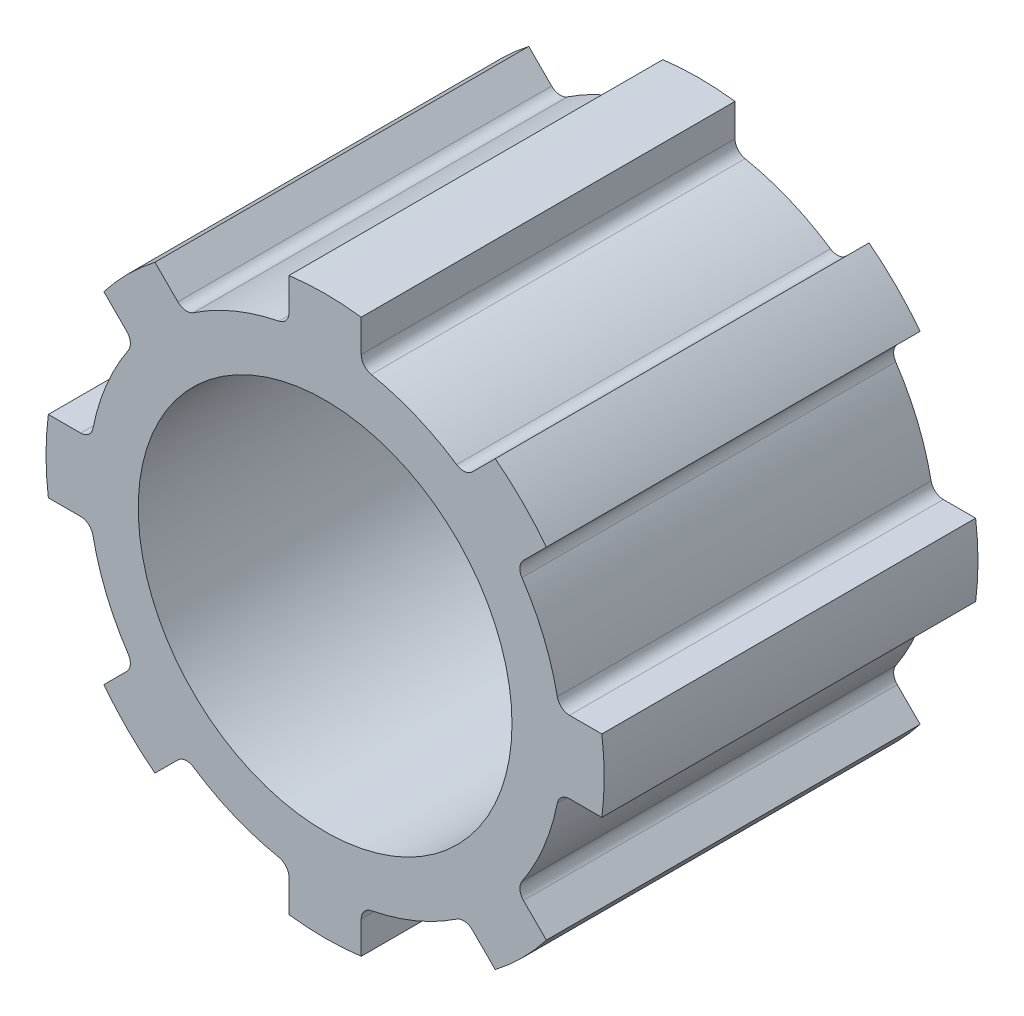
from build123d import *

# Parameters (mm, degrees)
SKETCH_2_W                       = 60
SKETCH_2_H                       = 14.8
CUT_EXTRUDE_1_DEPTH              = 88.258695842
FILLET_2_R                       = 2
PATTERN_CIRCULAR_1_COUNT         = 8
FILLET_2_OF_PATTERN_CIRCULAR_1_R = 2


with BuildPart() as part:
    # Эскиз2 → Повернуть1 (revolve)
    with BuildSketch(Plane(origin=(0, 0, 0), x_dir=(0, 0, -1), z_dir=(1, 0, 0)), mode=Mode.PRIVATE) as revolve_1_sk:
        with Locations((30, 37.4)):
            Rectangle(SKETCH_2_W, SKETCH_2_H)
    revolve(revolve_1_sk.sketch.rotate(Axis((0, 0, 0), (0, 0, -1)), 90), axis=Axis((0, 0, 0), (0, 0, -1)))

    # Эскиз4 → Вырез-Вытянуть1 (cut, through all)
    with BuildSketch(Plane.XY):
        with BuildLine():
            Line((-5.8, 37.554760018), (-5.8, 44.422967033))
            ThreePointArc((-5.8, 44.422967033), (-11.571918734, 43.279679953), (-17.14421777, 41.389803057))
            Line((-17.14421777, 41.389803057), (-14.54197043, 35.107422235))
            ThreePointArc((-14.54197043, 35.107422235), (-10.244330422, 36.5930826), (-5.8, 37.554760018))
        make_face()
        with BuildLine():
            Line((5.8, 37.554760018), (5.8, 44.422967033))
            ThreePointArc((5.8, 44.422967033), (11.571918734, 43.279679953), (17.14421777, 41.389803057))
            Line((17.14421777, 41.389803057), (14.54197043, 35.107422235))
            ThreePointArc((14.54197043, 35.107422235), (10.244330422, 36.5930826), (5.8, 37.554760018))
        make_face()
    cut_extrude_1 = extrude(amount=-CUT_EXTRUDE_1_DEPTH, mode=Mode.SUBTRACT)

    # Скругление2
    fillet_2_edges = [part.edges().sort_by_distance(p)[0] for p in [
        (-5.8, 37.554760018, -30),
        (5.8, 37.554760018, -30),
    ]]
    fillet(fillet_2_edges, radius=FILLET_2_R)

    # Круговой массив1: Вырез-Вытянуть1 ×8 about axis
    pattern_circular_1_axis = Axis((0, 0, 0), (0, 0, 1))
    for i in range(1, PATTERN_CIRCULAR_1_COUNT):
        add(cut_extrude_1.rotate(pattern_circular_1_axis, i * 360 / PATTERN_CIRCULAR_1_COUNT), mode=Mode.SUBTRACT)

    # Скругление2 of Круговой массив1
    fillet_2_of_pattern_circular_1_edges = [part.edges().sort_by_distance(p)[0] for p in [
        (-30.656444805, 22.454006144, -30),
        (-22.454006144, 30.656444805, -30),
        (-37.554760018, -5.8, -30),
        (-37.554760018, 5.8, -30),
        (-22.454006144, -30.656444805, -30),
        (-30.656444805, -22.454006144, -30),
        (5.8, -37.554760018, -30),
        (-5.8, -37.554760018, -30),
        (30.656444805, -22.454006144, -30),
        (22.454006144, -30.656444805, -30),
        (37.554760018, 5.8, -30),
        (37.554760018, -5.8, -30),
        (22.454006144, 30.656444805, -30),
        (30.656444805, 22.454006144, -30),
    ]]
    fillet(fillet_2_of_pattern_circular_1_edges, radius=FILLET_2_OF_PATTERN_CIRCULAR_1_R)


solid = part.part
